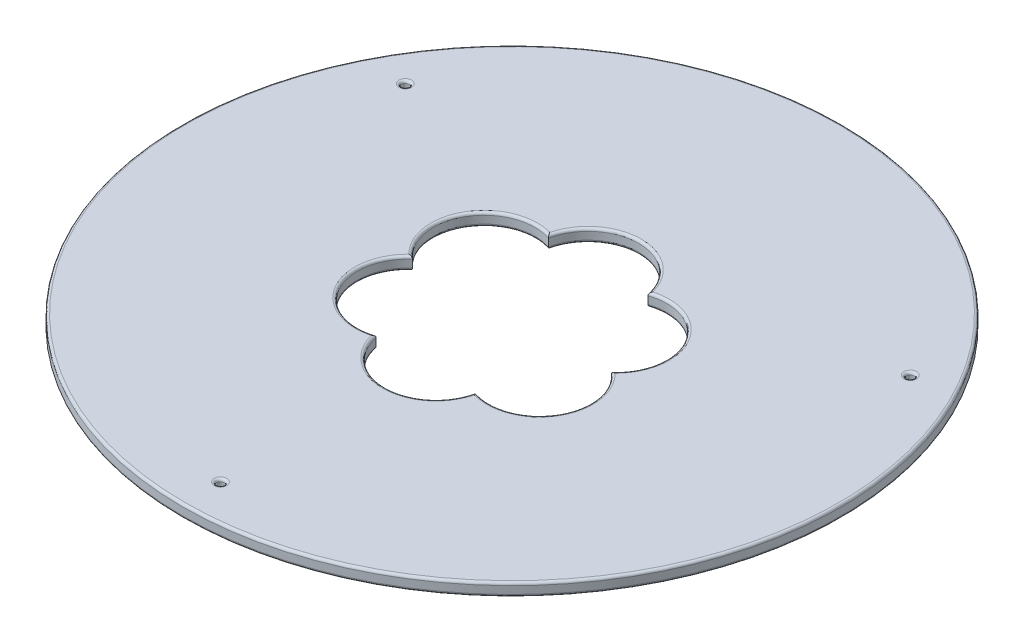
from build123d import *

# Parameters (mm, degrees)
SKETCH1_R           = 130
SKETCH1_R_2         = 1.5
BOSS_EXTRUDE1_DEPTH = 5
FILLET1_R           = 1


with BuildPart() as part:
    # Sketch1 → Boss-Extrude1 (new body)
    with BuildSketch(Plane(origin=(0, 0, 0), x_dir=(1, 0, 0), z_dir=(0, 1, 0))):
        with Locations(Location((0, 0, 0), (0, 0, 270))):
            Circle(SKETCH1_R)
        with Locations(Location((0, -115, 0), (0, 0, 270))):
            Circle(SKETCH1_R_2, mode=Mode.SUBTRACT)
        with BuildLine():
            ThreePointArc((19.604759334, -33.956439237), (0, -50), (-19.604759334, -33.956439237))
            ThreePointArc((-19.604759334, -33.956439237), (-43.301270189, -25), (-39.209518669, 0))
            ThreePointArc((-39.209518669, 0), (-43.301270189, 25), (-19.604759334, 33.956439237))
            ThreePointArc((-19.604759334, 33.956439237), (0, 50), (19.604759334, 33.956439237))
            ThreePointArc((19.604759334, 33.956439237), (43.301270189, 25), (39.209518669, 0))
            ThreePointArc((39.209518669, 0), (43.301270189, -25), (19.604759334, -33.956439237))
        make_face(mode=Mode.SUBTRACT)
        with Locations(Location((-99.592921435, 57.5, 0), (0, 0, 270))):
            Circle(SKETCH1_R_2, mode=Mode.SUBTRACT)
        with Locations(Location((99.592921435, 57.5, 0), (0, 0, 270))):
            Circle(SKETCH1_R_2, mode=Mode.SUBTRACT)
    extrude(amount=BOSS_EXTRUDE1_DEPTH)

    # Fillet1
    fillet1_edges = [part.edges().sort_by_distance(p)[0] for p in [
        (-43.301270189, 5, 25),
        (-43.301270189, 5, -25),
        (0, 0, -130),
        (0, 5, -50),
        (-99.592921435, 0, -59),
        (99.592921435, 0, -59),
        (0, 0, 113.5),
        (0, 0, 50),
        (43.301270189, 5, -25),
        (43.301270189, 0, 25),
        (43.301270189, 0, -25),
        (0, 0, -50),
        (-43.301270189, 0, -25),
        (-43.301270189, 0, 25),
        (43.301270189, 5, 25),
        (0, 5, 50),
        (0, 5, 113.5),
        (99.592921435, 5, -59),
        (-99.592921435, 5, -59),
        (0, 5, -130),
    ]]
    fillet(fillet1_edges, radius=FILLET1_R)


solid = part.part
